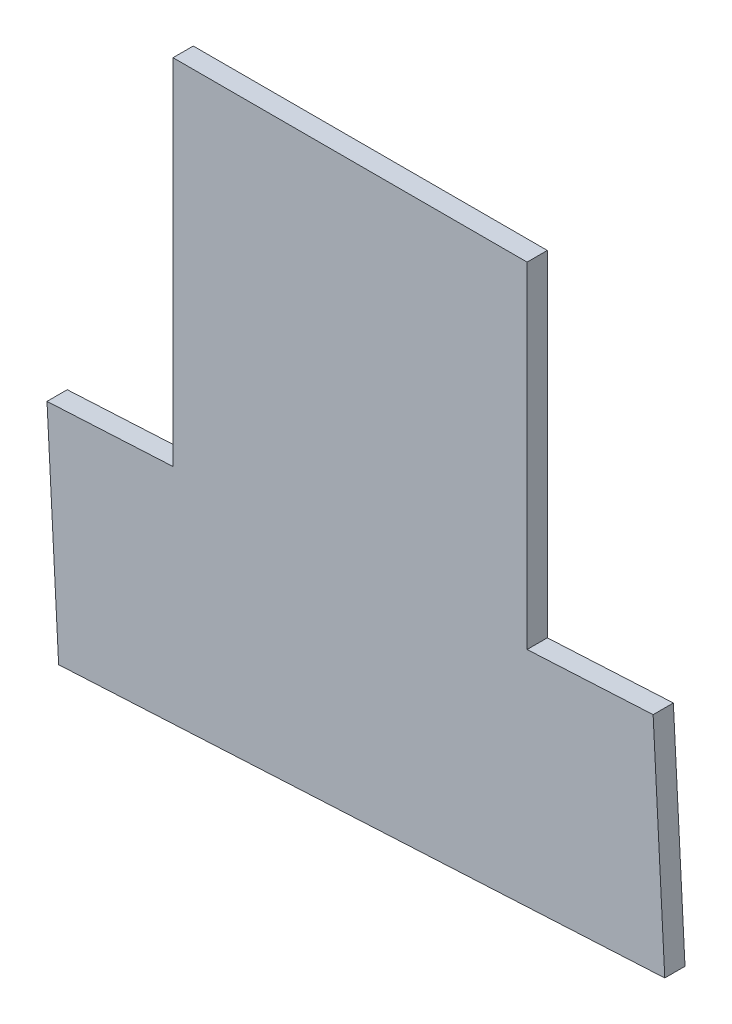
from build123d import *

# Parameters (mm, degrees)
EXTRUDE_1_DEPTH = 2


with BuildPart() as part:
    # 草图1 → 凸台-拉伸1 (new body)
    with BuildSketch(Plane.XY):
        Polygon((0, 1.834272275), (0, 35), (-35, 35), (-35, 0), (-47.458886487, -0.652942573), (-46.307494561, -22.622792291), (13.610277524, -19.482634917), (12.458886487, 2.487214848), align=None)
    extrude(amount=EXTRUDE_1_DEPTH)


solid = part.part
